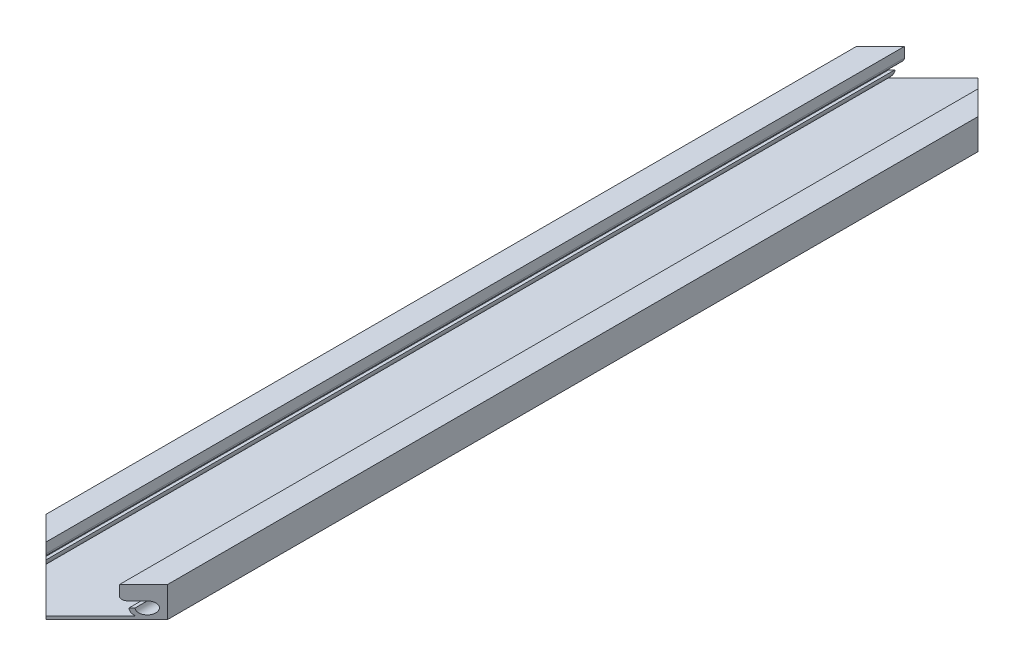
from build123d import *

# Parameters (mm, degrees)
SKETCH_1_W          = 60
SKETCH_1_H          = 15
EXTRUDE_1_DEPTH     = 460
SKETCH_2_R          = 3
CUT_EXTRUDE_1_DEPTH = 462.038230519
CUT_EXTRUDE_2_DEPTH = 462.038230519
SKETCH_4_W          = 36.3
SKETCH_4_H          = 7
CUT_EXTRUDE_3_DEPTH = 462.038230519
FILLET_1_R          = 2
CUT_EXTRUDE_4_DEPTH = 462.221205063


with BuildPart() as part:
    # 스케치1 → 보스-돌출1 (new body)
    with BuildSketch(Plane.XY):
        Rectangle(SKETCH_1_W, SKETCH_1_H)
    extrude(amount=EXTRUDE_1_DEPTH)

    # 스케치2 → 컷-돌출1 (cut, through all)
    with BuildSketch(Plane(origin=(0, 0, 0), x_dir=(-1, 0, 0), z_dir=(0, 0, -1))):
        with Locations((-25, -2.5)):
            Circle(SKETCH_2_R)
        with Locations((25, -2.5)):
            Circle(SKETCH_2_R)
    extrude(amount=-CUT_EXTRUDE_1_DEPTH, mode=Mode.SUBTRACT)

    # 스케치3 → 컷-돌출2 (cut, through all)
    with BuildSketch(Plane(origin=(0, 0, 0), x_dir=(-1, 0, 0), z_dir=(0, 0, -1))):
        with BuildLine():
            Line((-22.171572875, -6), (22.171572875, -6))
            ThreePointArc((22.171572875, -6), (20.939339828, -4.439339828), (20.5, -2.5))
            Line((20.5, -2.5), (25, -2.5))
            Line((25, -2.5), (25, 0.5))
            Line((25, 0.5), (-25, 0.5))
            Line((-25, 0.5), (-25, -2.5))
            Line((-25, -2.5), (-20.5, -2.5))
            ThreePointArc((-20.5, -2.5), (-20.939339828, -4.439339828), (-22.171572875, -6))
        make_face()
    extrude(amount=-CUT_EXTRUDE_2_DEPTH, mode=Mode.SUBTRACT)

    # 스케치4 → 컷-돌출3 (cut, through all)
    with BuildSketch(Plane(origin=(0, 0, 0), x_dir=(-1, 0, 0), z_dir=(0, 0, -1))):
        with Locations((0.006888359, 4)):
            Rectangle(SKETCH_4_W, SKETCH_4_H)
    extrude(amount=-CUT_EXTRUDE_3_DEPTH, mode=Mode.SUBTRACT)

    # 필렛1
    fillet_1_edges = [part.edges().sort_by_distance(p)[0] for p in [
        (-18.156888359, 0.5, 230),
        (18.143111641, 0.5, 230),
    ]]
    fillet(fillet_1_edges, radius=FILLET_1_R)

    # 스케치5 → 컷-돌출4 (cut, through all)
    with BuildSketch(Plane.XZ.offset(7.5)):
        Polygon((30, 460), (0, 460), (30, 430), align=None)
        Polygon((0, 460), (-30, 460), (-30, 430), align=None)
        Polygon((0, 0), (-30, 30), (-30, 0), align=None)
        Polygon((30, 30), (0, 0), (30, 0), align=None)
    extrude(amount=-CUT_EXTRUDE_4_DEPTH, mode=Mode.SUBTRACT)


solid = part.part
